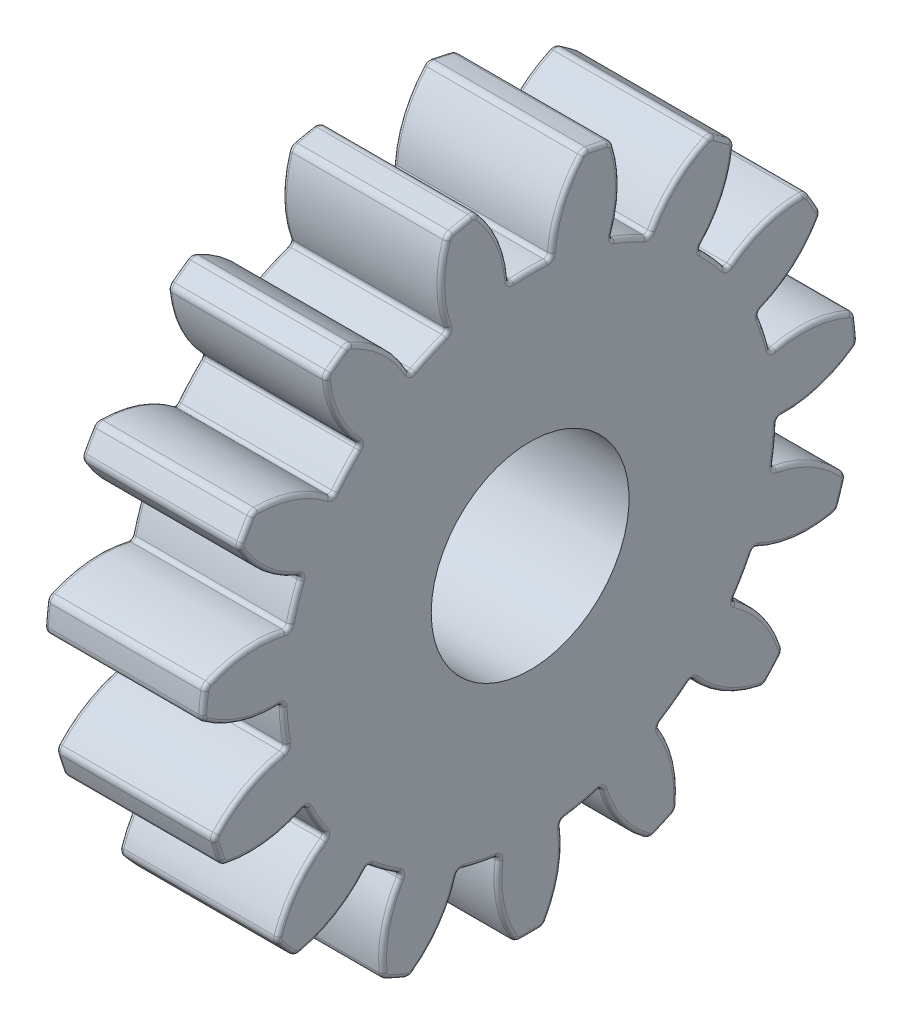
from build123d import *

# Parameters (mm, degrees)
BASPROSKE_W        = 4
BASPROSKE_H        = 8.5
TOOTHCUT_DEPTH     = 13.668859459
TEETHCUTS_COUNT    = 15
TEETHCUTS_ANGLE    = 336
BORSKE_R           = 2.5
BORE_DEPTH         = 50.0000508
SKETCH1_OUTSIDE_W  = 23.796
SKETCH1_OUTSIDE_H  = 23.705
SKETCH1_OUTSIDE_R  = 8.3
CUT_EXTRUDE1_DEPTH = 10
FILLET1_R          = 0.2
FILLET2_R          = 0.1


with BuildPart() as part:
    # BasProSke → Base-Revolve (revolve)
    with BuildSketch(Plane(origin=(0, 0, 0), x_dir=(1, 0, 0), z_dir=(0, 1, 0)), mode=Mode.PRIVATE) as base_revolve_sk:
        with Locations((2, 4.25)):
            Rectangle(BASPROSKE_W, BASPROSKE_H)
    revolve(base_revolve_sk.sketch.rotate(Axis((-10, 0, 0), (1, 0, 0)), 180), axis=Axis((-10, 0, 0), (1, 0, 0)))

    # TooCutSke → ToothCut (cut, through all)
    with BuildSketch(Plane(origin=(0, 0, 0), x_dir=(0, 0, -1), z_dir=(1, 0, 0))):
        with BuildLine():
            ThreePointArc((0.531576138, 6.226349477), (0, 6.249), (-0.531576138, 6.226349477))
            ThreePointArc((-0.531576138, 6.226349477), (-0.830301624, 7.411024729), (-1.576608494, 8.378350125))
            ThreePointArc((-1.576608494, 8.378350125), (0, 8.5254), (1.576608494, 8.378350125))
            ThreePointArc((1.576608494, 8.378350125), (0.830301624, 7.411024729), (0.531576138, 6.226349477))
        make_face()
    toothcut = extrude(amount=TOOTHCUT_DEPTH, mode=Mode.SUBTRACT)

    # TeethCuts: ToothCut ×15 about axis
    teethcuts_axis = Axis((-10, 0, 0), (1, 0, 0))
    for i in range(1, TEETHCUTS_COUNT):
        add(toothcut.rotate(teethcuts_axis, i * TEETHCUTS_ANGLE / (TEETHCUTS_COUNT - 1)), mode=Mode.SUBTRACT)

    # BorSke → Bore (cut, symmetric)
    with BuildSketch(Plane(origin=(0, 0, 0), x_dir=(0, 0, -1), z_dir=(1, 0, 0))):
        with Locations(Location((0, 0, 0), (0, 0, 180))):
            Circle(BORSKE_R)
    extrude(amount=BORE_DEPTH, both=True, mode=Mode.SUBTRACT)

    # Sketch1 outside → Cut-Extrude1 (cut)
    with BuildSketch(Plane(origin=(4, 0, 0), x_dir=(0, 0, -1), z_dir=(1, 0, 0))):
        with Locations((0, -0.0715)):
            Rectangle(SKETCH1_OUTSIDE_W, SKETCH1_OUTSIDE_H)
        Circle(SKETCH1_OUTSIDE_R, mode=Mode.SUBTRACT)
    extrude(amount=-CUT_EXTRUDE1_DEPTH, mode=Mode.SUBTRACT)

    # Fillet1
    fillet1_edges = [part.edges().sort_by_distance(p)[0] for p in [
        (2, -2.22028244, 7.997521234),
        (2, 8.185792687, 1.372150896),
        (2, 8.036197776, 2.075939621),
        (2, 0.508985779, -8.284378883),
        (2, 1.224556002, -8.209169422),
        (2, 8.185792687, -1.372150896),
        (2, 8.036197776, -2.075939621),
        (2, 3.834542103, -7.361133531),
        (2, 4.457657587, -7.001377639),
        (2, 6.919989678, -4.582984056),
        (2, 6.497071262, -5.165081317),
        (2, -2.22028244, -7.997521234),
        (2, -2.90457881, -7.775179865),
        (2, -7.721627264, -3.044088105),
        (2, -7.428975457, -3.701394827),
        (2, -5.281213877, -6.40302897),
        (2, -5.815915336, -5.921581613),
        (2, -8.29219969, -0.359755892),
        (2, -8.29219969, 0.359755892),
        (2, -5.281213877, 6.40302897),
        (2, -5.815915336, 5.921581613),
        (2, -7.721627264, 3.044088105),
        (2, -7.428975457, 3.701394827),
        (2, 6.919989678, 4.582984056),
        (2, 6.497071262, 5.165081317),
        (2, 4.457657587, 7.001377639),
        (2, 3.834542103, 7.361133531),
        (2, 1.224556002, 8.209169422),
        (2, 0.508985779, 8.284378883),
        (2, -2.90457881, 7.775179865),
    ]]
    fillet(fillet1_edges, radius=FILLET1_R)

    # Fillet2
    fillet2_edges = [part.edges().sort_by_distance(p)[0] for p in [
        (4, -0.009725686, 7.270316093),
        (4, -0.653198367, 6.214767324),
        (2, -0.122166634, 6.24780572),
        (0, -0.009725686, 7.270316093),
        (0, -0.653198367, 6.214767324),
        (2, -1.179494851, 6.136676046),
        (4, 2.948219105, 6.645720035),
        (4, 1.931047198, 5.94315217),
        (2, 2.429606752, 5.757344182),
        (0, 2.948219105, 6.645720035),
        (0, 1.931047198, 5.94315217),
        (2, 1.418488851, 6.085876303),
        (4, 5.39639003, 4.872018609),
        (4, 4.181397159, 4.643912014),
        (2, 4.561279057, 4.271385532),
        (0, 5.39639003, 4.872018609),
        (0, 4.181397159, 4.643912014),
        (2, 3.771202944, 4.982773259),
        (4, 7.231505152, -0.750282561),
        (4, -5.409405538, 4.857563422),
        (4, -5.055547198, 3.673070042),
        (2, -4.724769925, 4.089810528),
        (0, -5.409405538, 4.857563422),
        (4, 6.249, 0),
        (0, -5.055547198, 3.673070042),
        (2, -5.349675154, 3.229702268),
        (2, 6.226349477, -0.531576138),
        (0, 7.231505152, -0.750282561),
        (4, -6.917486898, 2.23740155),
        (4, -6.112444357, 1.299240156),
        (2, -5.979767908, 1.814490772),
        (0, -6.917486898, 2.23740155),
        (0, -6.112444357, 1.299240156),
        (2, -6.200809696, 0.774570923),
        (4, -2.965988818, 6.637808449),
        (4, -3.1245, 5.411792748),
        (2, -2.652816299, 5.657964889),
        (0, -2.965988818, 6.637808449),
        (0, -3.1245, 5.411792748),
        (2, -3.573533178, 5.126388751),
        (0, 6.249, 0),
        (4, -6.291415587, -3.643580738),
        (2, 6.226349477, 0.531576138),
        (4, -5.055547198, -3.673070042),
        (2, -5.349675154, -3.229702268),
        (0, -6.291415587, -3.643580738),
        (0, -5.055547198, -3.673070042),
        (2, -4.724769925, -4.089810528),
        (4, -4.265516333, -5.887525889),
        (4, -3.1245, -5.411792748),
        (2, -3.573533178, -5.126388751),
        (0, -4.265516333, -5.887525889),
        (0, -3.1245, -5.411792748),
        (2, -2.652816299, -5.657964889),
        (4, -7.22947193, -0.769627377),
        (4, -6.112444357, -1.299240156),
        (2, -6.200809696, -0.774570923),
        (0, -7.22947193, -0.769627377),
        (0, -6.112444357, -1.299240156),
        (2, -5.979767908, -1.814490772),
        (4, 4.281252824, -5.876092659),
        (4, 4.181397159, -4.643912014),
        (2, 3.771202944, -4.982773259),
        (0, 4.281252824, -5.876092659),
        (0, 4.181397159, -4.643912014),
        (2, 4.561279057, -4.271385532),
        (4, 6.301141273, -3.626735355),
        (4, 5.708745565, -2.541697283),
        (2, 5.471841788, -3.018103451),
        (0, 6.301141273, -3.626735355),
        (0, 5.708745565, -2.541697283),
        (2, 5.904264776, -2.046865518),
        (4, 1.521096868, -7.109420159),
        (4, 1.931047198, -5.94315217),
        (2, 1.418488851, -6.085876303),
        (0, 1.521096868, -7.109420159),
        (0, 1.931047198, -5.94315217),
        (2, 2.429606752, -5.757344182),
        (4, -1.502070555, -7.113464327),
        (4, -0.653198367, -6.214767324),
        (2, -1.179494851, -6.136676046),
        (0, -1.502070555, -7.113464327),
        (0, -0.653198367, -6.214767324),
        (2, -0.122166634, -6.24780572),
        (0, 6.301141273, 3.626735355),
        (4, 6.911476093, 2.255900905),
        (4, 5.708745565, 2.541697283),
        (2, 5.904264776, 2.046865518),
        (0, 6.911476093, 2.255900905),
        (0, 5.708745565, 2.541697283),
        (2, 5.471841788, 3.018103451),
        (4, -6.291415587, 3.643580738),
        (4, 0.867586245, 8.254531732),
        (4, -1.502070555, 7.113464327),
        (4, -2.564841053, 7.893769085),
        (4, -4.265516333, 5.887525889),
        (4, -5.553784033, 6.168102051),
        (4, -7.582427298, 3.375914138),
        (4, -7.22947193, 0.769627377),
        (4, -8.3, 0),
        (4, -6.917486898, -2.23740155),
        (4, -7.582427298, -3.375914138),
        (4, -5.409405538, -4.857563422),
        (4, -5.553784033, -6.168102051),
        (4, -2.965988818, -6.637808449),
        (4, -2.564841053, -7.893769085),
        (4, -0.009725686, -7.270316093),
        (4, 0.867586245, -8.254531732),
        (4, 2.948219105, -6.645720035),
        (4, 4.15, -7.188010851),
        (4, 5.39639003, -4.872018609),
        (4, 6.714841053, -4.878617594),
        (4, 6.911476093, -2.255900905),
        (4, 8.118625086, -1.725667034),
        (4, 7.231505152, 0.750282561),
        (4, 8.118625086, 1.725667034),
        (4, 6.301141273, 3.626735355),
        (4, 6.714841053, 4.878617594),
        (4, 4.281252824, 5.876092659),
        (4, 4.15, 7.188010851),
        (4, 1.521096868, 7.109420159),
        (4, 8.015116, -2.058258608),
        (4, 8.159342011, -1.379728573),
        (4, 8.159342011, 1.379728573),
        (4, 8.015116, 2.058258608),
        (4, 6.892743663, 4.57914815),
        (4, 6.485003617, 5.140354178),
        (4, 4.434327317, 6.986791412),
        (4, 3.833575195, 7.333635811),
        (4, 1.209175494, 8.186354965),
        (4, 0.519286794, 8.258865189),
        (4, -2.225053758, 7.970423374),
        (4, 4.434327317, -6.986791412),
        (4, 3.833575195, -7.333635811),
        (4, 6.485003617, -5.140354178),
        (4, 6.892743663, -4.57914815),
        (4, 1.209175494, -8.186354965),
        (4, 0.519286794, -8.258865189),
        (4, -2.225053758, -7.970423374),
        (4, -2.88479101, -7.756061746),
        (4, -5.274551, -6.376333173),
        (4, -5.790062242, -5.912164766),
        (4, -7.412030457, -3.679717039),
        (4, -7.694179111, -3.046000787),
        (4, -8.267902512, 0.3468444),
        (4, -8.267902512, -0.3468444),
        (4, -7.694179111, 3.046000787),
        (4, -5.790062242, 5.912164766),
        (4, -2.88479101, 7.756061746),
        (4, -5.274551, 6.376333173),
        (4, -7.412030457, 3.679717039),
        (0, -7.582427298, 3.375914138),
        (0, 0.867586245, -8.254531732),
        (0, -2.564841053, -7.893769085),
        (0, -5.553784033, -6.168102051),
        (0, -7.582427298, -3.375914138),
        (0, -8.3, 0),
        (0, -5.553784033, 6.168102051),
        (0, -2.564841053, 7.893769085),
        (0, 0.867586245, 8.254531732),
        (0, 4.15, 7.188010851),
        (0, 6.714841053, 4.878617594),
        (0, 8.118625086, 1.725667034),
        (0, 8.118625086, -1.725667034),
        (0, 6.714841053, -4.878617594),
        (0, 4.15, -7.188010851),
        (0, 8.015116, -2.058258608),
        (0, 8.159342011, -1.379728573),
        (0, 8.159342011, 1.379728573),
        (0, 8.015116, 2.058258608),
        (0, 6.892743663, 4.57914815),
        (0, 6.485003617, 5.140354178),
        (0, 4.434327317, 6.986791412),
        (0, 3.833575195, 7.333635811),
        (0, 1.209175494, 8.186354965),
        (0, 0.519286794, 8.258865189),
        (0, -2.225053758, 7.970423374),
        (0, 4.434327317, -6.986791412),
        (0, 3.833575195, -7.333635811),
        (0, 6.485003617, -5.140354178),
        (0, 6.892743663, -4.57914815),
        (0, 1.209175494, -8.186354965),
        (0, 0.519286794, -8.258865189),
        (0, -2.225053758, -7.970423374),
        (0, -2.88479101, -7.756061746),
        (0, -5.274551, -6.376333173),
        (0, -5.790062242, -5.912164766),
        (0, -7.412030457, -3.679717039),
        (0, -7.694179111, -3.046000787),
        (0, -8.267902512, 0.3468444),
        (0, -8.267902512, -0.3468444),
        (0, -7.694179111, 3.046000787),
        (0, -5.790062242, 5.912164766),
        (0, -2.88479101, 7.756061746),
        (0, -5.274551, 6.376333173),
        (0, -7.412030457, 3.679717039),
        (0, -0.009725686, -7.270316093),
        (0, 2.948219105, -6.645720035),
        (0, 6.911476093, -2.255900905),
        (0, 5.39639003, -4.872018609),
        (0, -6.917486898, -2.23740155),
        (0, -2.965988818, -6.637808449),
        (0, -5.409405538, -4.857563422),
        (0, -4.265516333, 5.887525889),
        (0, -7.22947193, 0.769627377),
        (0, -6.291415587, 3.643580738),
        (0, 4.281252824, 5.876092659),
        (0, 1.521096868, 7.109420159),
        (0, -1.502070555, 7.113464327),
        (0, 7.231505152, 0.750282561),
    ]]
    fillet(fillet2_edges, radius=FILLET2_R)


solid = part.part
